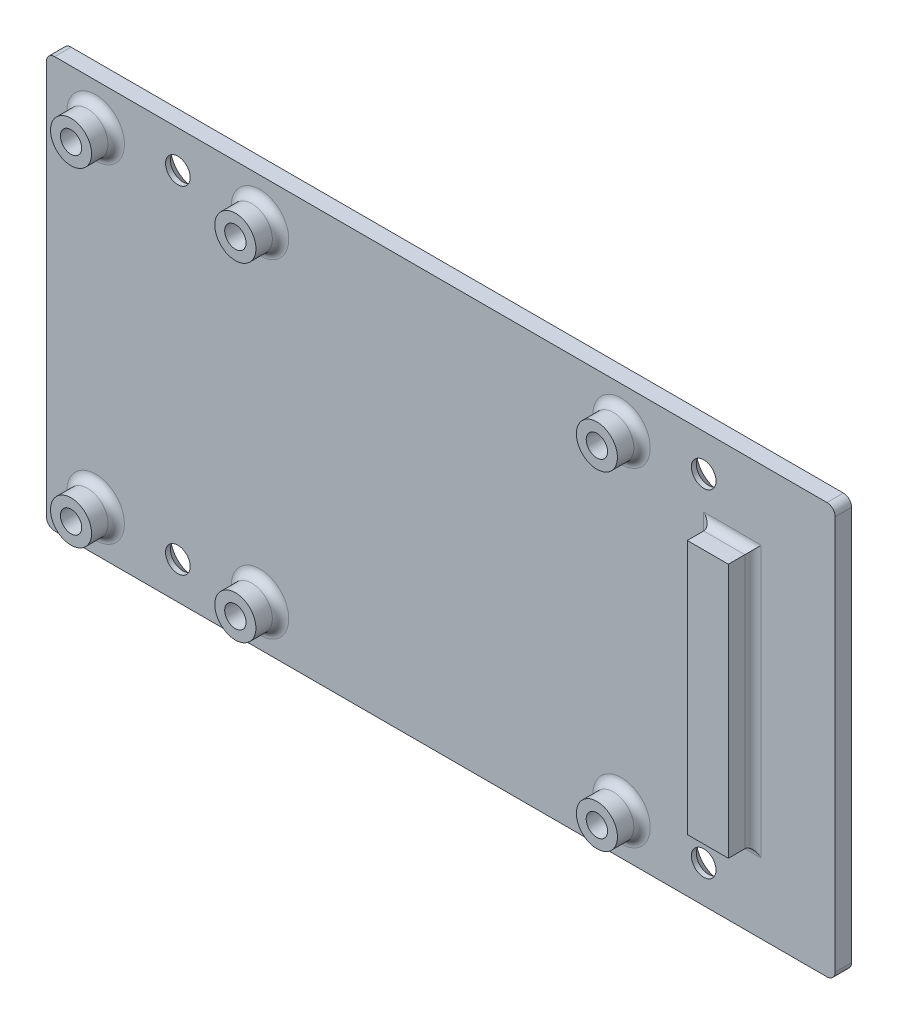
from build123d import *

# Parameters (mm, degrees)
SKETCH_1_R      = 1.5
EXTRUDE_2_DEPTH = 2
CHAMFER_1_SIZE  = 1.4
SKETCH_3_R      = 2.5
SKETCH_3_R_2    = 1.3
SKETCH_3_W      = 5
SKETCH_3_H      = 31
EXTRUDE_3_DEPTH = 3
FILLET_1_R      = 1


with BuildPart() as part:
    # Эскиз1 → Бобышка-Вытянуть2 (new body)
    with BuildSketch(Plane(origin=(0, 0, 60.753798787), x_dir=(-1, 0, 0), z_dir=(0, 0, -1))):
        with BuildLine():
            Line((-84.550134069, 64.543755027), (-84.550134069, 29.543755027))
            Line((-84.550134069, 29.543755027), (-84.550134069, 23.043755027))
            ThreePointArc((-84.550134069, 23.043755027), (-84.25724085, 22.336648246), (-83.550134069, 22.043755027))
            Line((-83.550134069, 22.043755027), (10.449865931, 22.043755027))
            ThreePointArc((10.449865931, 22.043755027), (11.156972713, 22.336648246), (11.449865931, 23.043755027))
            Line((11.449865931, 23.043755027), (11.449865931, 71.043755027))
            ThreePointArc((11.449865931, 71.043755027), (11.156972713, 71.750861809), (10.449865931, 72.043755027))
            Line((10.449865931, 72.043755027), (-83.550134069, 72.043755027))
            ThreePointArc((-83.550134069, 72.043755027), (-84.25724085, 71.750861809), (-84.550134069, 71.043755027))
            Line((-84.550134069, 71.043755027), (-84.550134069, 64.543755027))
        make_face()
        with Locations((-4.550134069, 67.543755027)):
            Circle(SKETCH_1_R, mode=Mode.SUBTRACT)
        with Locations((-68.550134069, 67.543755027)):
            Circle(SKETCH_1_R, mode=Mode.SUBTRACT)
        with Locations((-68.550134069, 26.543755027)):
            Circle(SKETCH_1_R, mode=Mode.SUBTRACT)
        with Locations((-4.550134069, 26.543755027)):
            Circle(SKETCH_1_R, mode=Mode.SUBTRACT)
    extrude(amount=EXTRUDE_2_DEPTH)

    # Фаска1
    chamfer_1_edges = [part.edges().sort_by_distance(p)[0] for p in [
        (6.050134069, 67.543755027, 58.753798787),
        (70.050134069, 67.543755027, 58.753798787),
        (70.050134069, 26.543755027, 58.753798787),
        (6.050134069, 26.543755027, 58.753798787),
    ]]
    chamfer(chamfer_1_edges, length=CHAMFER_1_SIZE)

    # Эскиз3 → Бобышка-Вытянуть3 (add)
    # profile 1 of 7: a face of its own
    with BuildSketch(Plane.XY.offset(60.753798787)):
        with Locations(Location((14.550134069, 67.043755027, 0), (0, 0, 180))):
            Circle(SKETCH_3_R)
        with Locations((14.550134069, 67.043755027)):
            Circle(SKETCH_3_R_2, mode=Mode.SUBTRACT)
    # profile 2 of 7: a face of its own
    with BuildSketch(Plane.XY.offset(60.753798787)):
        with Locations(Location((58.550134069, 67.043755027, 0), (0, 0, 180))):
            Circle(SKETCH_3_R)
        with Locations(Location((58.550134069, 67.043755027, 0), (0, 0, 180))):
            Circle(SKETCH_3_R_2, mode=Mode.SUBTRACT)
    # profile 3 of 7: a face of its own
    with BuildSketch(Plane.XY.offset(60.753798787)):
        with Locations(Location((58.550134069, 27.043755027, 0), (0, 0, 180))):
            Circle(SKETCH_3_R)
        with Locations((58.550134069, 27.043755027)):
            Circle(SKETCH_3_R_2, mode=Mode.SUBTRACT)
    # profile 4 of 7: a face of its own
    with BuildSketch(Plane.XY.offset(60.753798787)):
        with Locations(Location((14.550134069, 27.043755027, 0), (0, 0, 180))):
            Circle(SKETCH_3_R)
        with Locations(Location((14.550134069, 27.043755027, 0), (0, 0, 180))):
            Circle(SKETCH_3_R_2, mode=Mode.SUBTRACT)
    # profile 5 of 7: a face of its own
    with BuildSketch(Plane.XY.offset(60.753798787)):
        with Locations(Location((-5.449865931, 67.043755027, 0), (0, 0, 180))):
            Circle(SKETCH_3_R)
        with Locations((-5.449865931, 67.043755027)):
            Circle(SKETCH_3_R_2, mode=Mode.SUBTRACT)
    # profile 6 of 7: a face of its own
    with BuildSketch(Plane.XY.offset(60.753798787)):
        with Locations(Location((-5.449865931, 27.043755027, 0), (0, 0, 180))):
            Circle(SKETCH_3_R)
        with Locations(Location((-5.449865931, 27.043755027, 0), (0, 0, 180))):
            Circle(SKETCH_3_R_2, mode=Mode.SUBTRACT)
    # profile 7 of 7: a face of its own
    with BuildSketch(Plane.XY.offset(60.753798787)):
        with Locations((72.050134069, 47.043755027)):
            Rectangle(SKETCH_3_W, SKETCH_3_H)
    extrude(amount=EXTRUDE_3_DEPTH)

    # Скругление1
    fillet_1_edges = [part.edges().sort_by_distance(p)[0] for p in [
        (-2.949865931, 67.043755027, 60.753798787),
        (-2.949865931, 27.043755027, 60.753798787),
        (69.550134069, 47.043755027, 60.753798787),
        (72.050134069, 31.543755027, 60.753798787),
        (74.550134069, 47.043755027, 60.753798787),
        (72.050134069, 62.543755027, 60.753798787),
        (17.050134069, 67.043755027, 60.753798787),
        (61.050134069, 67.043755027, 60.753798787),
        (61.050134069, 27.043755027, 60.753798787),
        (17.050134069, 27.043755027, 60.753798787),
    ]]
    fillet(fillet_1_edges, radius=FILLET_1_R)


solid = part.part
